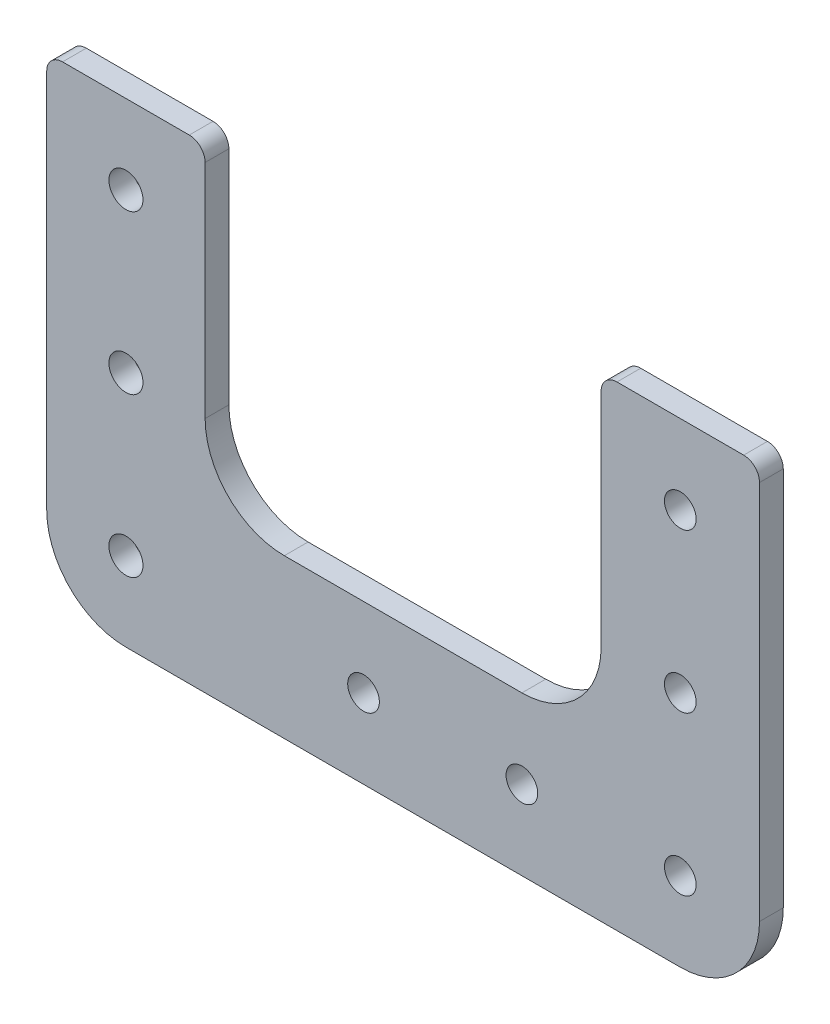
from build123d import *

# Parameters (mm, degrees)
SKETCH_1_W          = 20
SKETCH_1_H          = 60
EXTRUDE_1_DEPTH     = 3
SKETCH_2_W          = 60
SKETCH_2_H          = 20
EXTRUDE_2_DEPTH     = 3
SKETCH_3_R          = 2
CUT_EXTRUDE_1_DEPTH = 3
FILLET_1_R          = 10
SKETCH_4_W          = 20
SKETCH_4_H          = 60
SKETCH_4_W_2        = 10
SKETCH_4_H_2        = 20
EXTRUDE_3_DEPTH     = 3
SKETCH_5_R          = 2.15
CUT_EXTRUDE_2_DEPTH = 93.244241013
FILLET_3_R          = 10
FILLET_4_R          = 2


with BuildPart() as part:
    # 草图1 → 凸台-拉伸1 (new body)
    with BuildSketch(Plane.XY):
        with Locations((10, 30)):
            Rectangle(SKETCH_1_W, SKETCH_1_H)
    extrude(amount=EXTRUDE_1_DEPTH)

    # 草图2 → 凸台-拉伸2 (add)
    with BuildSketch(Plane.XY.offset(3)):
        with Locations((-10, 10)):
            Rectangle(SKETCH_2_W, SKETCH_2_H)
    extrude(amount=-EXTRUDE_2_DEPTH)

    # 草图3 → 切除-拉伸1 (cut)
    with BuildSketch(Plane.XY.offset(3)):
        with Locations((10, 10)):
            Circle(SKETCH_3_R)
        with Locations((10, 30)):
            Circle(SKETCH_3_R)
        with Locations((10, 50)):
            Circle(SKETCH_3_R)
        with Locations(Location((-10, 10, 0), (0, 0, 180))):
            Circle(SKETCH_3_R)
        with Locations(Location((-30, 10, 0), (0, 0, 180))):
            Circle(SKETCH_3_R)
    extrude(amount=-CUT_EXTRUDE_1_DEPTH, mode=Mode.SUBTRACT)

    # 圆角1
    fillet_1_edges = [part.edges().sort_by_distance(p)[0] for p in [
        (0, 20, 1.5),
        (20, 0, 1.5),
    ]]
    fillet(fillet_1_edges, radius=FILLET_1_R)

    # 草图4 → 凸台-拉伸3 (add, through all)
    with BuildSketch(Plane.XY.offset(3)):
        with Locations((-60, 30)):
            Rectangle(SKETCH_4_W, SKETCH_4_H)
        with Locations((-45, 10)):
            Rectangle(SKETCH_4_W_2, SKETCH_4_H_2)
    extrude(amount=-EXTRUDE_3_DEPTH)

    # 草图5 → 切除-拉伸2 (cut, through all)
    with BuildSketch(Plane.XY.offset(3)):
        with Locations((-60, 10)):
            Circle(SKETCH_5_R)
        with Locations((-60, 30)):
            Circle(SKETCH_5_R)
        with Locations((-60, 50)):
            Circle(SKETCH_5_R)
    extrude(amount=-CUT_EXTRUDE_2_DEPTH, mode=Mode.SUBTRACT)

    # 圆角3
    fillet_3_edges = [part.edges().sort_by_distance(p)[0] for p in [
        (-50, 20, 1.5),
        (-70, 0, 1.5),
    ]]
    fillet(fillet_3_edges, radius=FILLET_3_R)

    # 圆角4
    fillet_4_edges = [part.edges().sort_by_distance(p)[0] for p in [
        (-50, 60, 1.5),
        (-70, 60, 1.5),
        (0, 60, 1.5),
        (20, 60, 1.5),
    ]]
    fillet(fillet_4_edges, radius=FILLET_4_R)


solid = part.part
